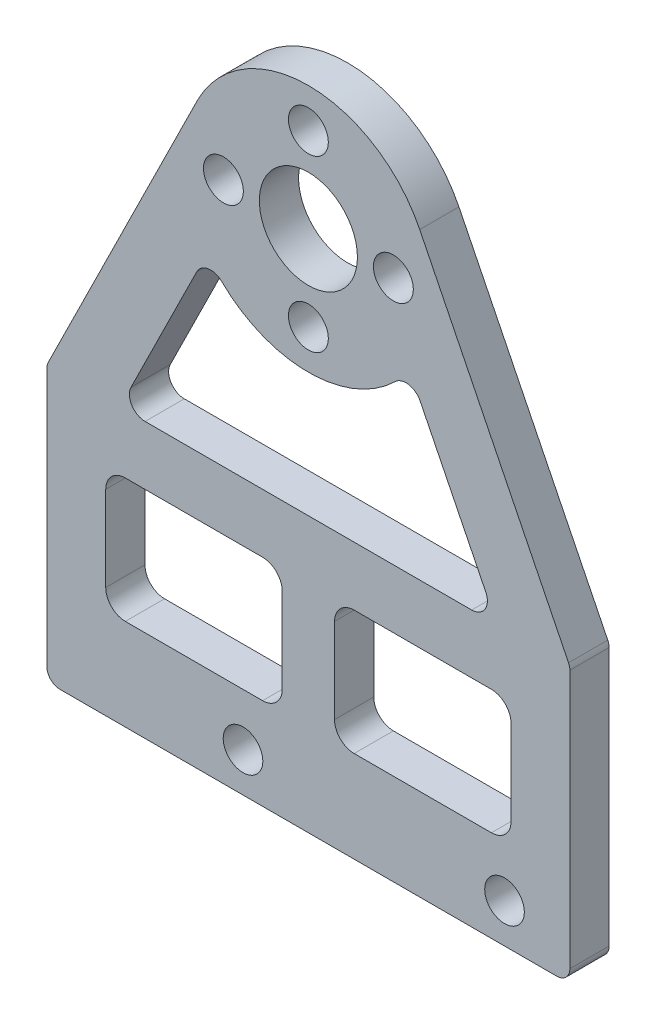
from build123d import *

# Parameters (mm, degrees)
SKETCH_1_R          = 1.525
SKETCH_1_R_2        = 3.75
EXTRUDE_1_DEPTH     = 3
FILLET_1_R          = 1
SKETCH_2_R          = 1.515
CUT_EXTRUDE_1_DEPTH = 10
CUT_EXTRUDE_2_DEPTH = 10
FILLET_2_R          = 1.2
SKETCH_4_W          = 31
SKETCH_4_H          = 9.5
CUT_EXTRUDE_3_DEPTH = 10
SKETCH_5_W          = 4
SKETCH_5_H          = 9.5
EXTRUDE_1_2_DEPTH   = 3
FILLET_3_R          = 1.5


with BuildPart() as part:
    # 草图1 → Extrude 1 (new body)
    with BuildSketch(Plane.XY):
        with BuildLine():
            Line((-20, -40), (20, -40))
            Line((20, -40), (20, -19))
            Line((20, -19), (8.514771251, 4.212917106))
            ThreePointArc((8.514771251, 4.212917106), (0, 9.5), (-8.514771251, 4.212917106))
            Line((-8.514771251, 4.212917106), (-20, -19))
            Line((-20, -19), (-20, -40))
        make_face()
        with Locations((0, 6.5)):
            Circle(SKETCH_1_R, mode=Mode.SUBTRACT)
        with Locations((6.5, 0)):
            Circle(SKETCH_1_R, mode=Mode.SUBTRACT)
        with Locations((0, -6.5)):
            Circle(SKETCH_1_R, mode=Mode.SUBTRACT)
        with Locations((-6.5, 0)):
            Circle(SKETCH_1_R, mode=Mode.SUBTRACT)
        Circle(SKETCH_1_R_2, mode=Mode.SUBTRACT)
    extrude(amount=EXTRUDE_1_DEPTH)

    # 圆角1
    fillet_1_edges = [part.edges().sort_by_distance(p)[0] for p in [
        (20, -40, 1.5),
        (-20, -40, 1.5),
        (-20, -19, 1.5),
        (20, -19, 1.5),
    ]]
    fillet(fillet_1_edges, radius=FILLET_1_R)

    # 草图2 → 切除-拉伸1 (cut)
    with BuildSketch(Plane(origin=(0, 0, 0), x_dir=(-1, 0, 0), z_dir=(0, 0, -1))):
        with Locations((-15, -37)):
            Circle(SKETCH_2_R)
        with Locations((5, -37)):
            Circle(SKETCH_2_R)
    extrude(amount=-CUT_EXTRUDE_1_DEPTH, mode=Mode.SUBTRACT)

    # 草图3 → 切除-拉伸2 (cut)
    with BuildSketch(Plane(origin=(0, 0, 0), x_dir=(-1, 0, 0), z_dir=(0, 0, -1))):
        with BuildLine():
            Line((-7.743606738, -5.50332215), (-14.421459062, -19))
            Line((-14.421459062, -19), (14.421459062, -19))
            Line((14.421459062, -19), (7.743606738, -5.50332215))
            ThreePointArc((7.743606738, -5.50332215), (0, -9.5), (-7.743606738, -5.50332215))
        make_face()
    extrude(amount=-CUT_EXTRUDE_2_DEPTH, mode=Mode.SUBTRACT)

    # 圆角2
    fillet_2_edges = [part.edges().sort_by_distance(p)[0] for p in [
        (7.743606738, -5.50332215, 1.5),
        (-7.743606738, -5.50332215, 1.5),
        (-14.421459062, -19, 1.5),
        (14.421459062, -19, 1.5),
    ]]
    fillet(fillet_2_edges, radius=FILLET_2_R)

    # 草图4 → 切除-拉伸3 (cut)
    with BuildSketch(Plane(origin=(0, 0, 0), x_dir=(-1, 0, 0), z_dir=(0, 0, -1))):
        with Locations((0, -28.25)):
            Rectangle(SKETCH_4_W, SKETCH_4_H)
    extrude(amount=-CUT_EXTRUDE_3_DEPTH, mode=Mode.SUBTRACT)

    # 草图5 → Extrude 1 2 (add)
    with BuildSketch(Plane(origin=(0, 0, 0), x_dir=(-1, 0, 0), z_dir=(0, 0, -1))):
        with Locations((0, -28.25)):
            Rectangle(SKETCH_5_W, SKETCH_5_H)
    extrude(amount=-EXTRUDE_1_2_DEPTH)

    # 圆角3
    fillet_3_edges = [part.edges().sort_by_distance(p)[0] for p in [
        (15.5, -33, 1.5),
        (15.5, -23.5, 1.5),
        (-15.5, -23.5, 1.5),
        (-15.5, -33, 1.5),
        (2, -33, 1.5),
        (2, -23.5, 1.5),
        (-2, -23.5, 1.5),
        (-2, -33, 1.5),
    ]]
    fillet(fillet_3_edges, radius=FILLET_3_R)


solid = part.part
